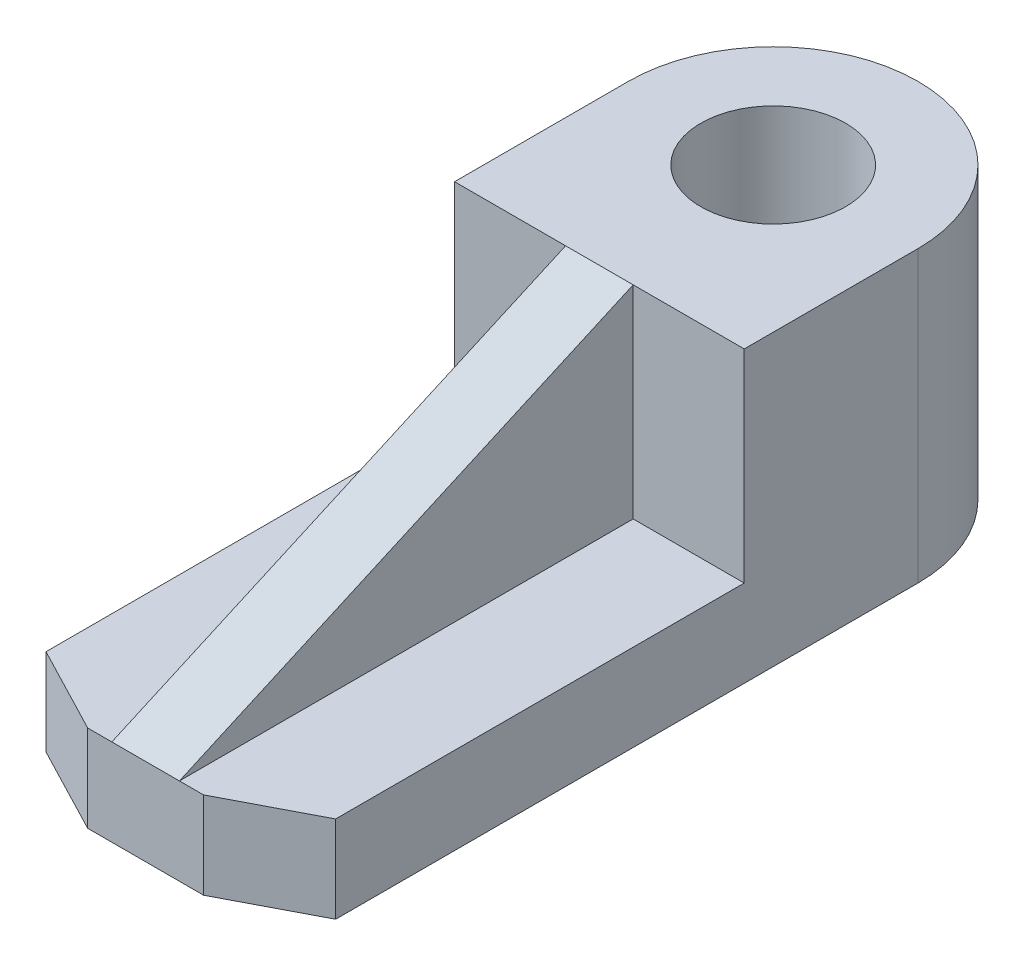
from build123d import *

# Parameters (mm, degrees)
BOSS_EXTRUDE1_DEPTH = 9
SKETCH2_R           = 7.5
BOSS_EXTRUDE2_DEPTH = 21
BOSS_EXTRUDE3_DEPTH = 3.5
SKETCH4_R           = 7.5
CUT_EXTRUDE1_DEPTH  = 85.242328054


with BuildPart() as part:
    # Sketch1 → Boss-Extrude1 (new body)
    with BuildSketch(Plane(origin=(0, 0, 0), x_dir=(1, 0, 0), z_dir=(0, 1, 0))):
        with BuildLine():
            Line((-5.007194245, 0), (6.992805755, 0))
            Line((6.992805755, 0), (15.992805755, 4.683453237))
            Line((15.992805755, 4.683453237), (15.992805755, 65))
            ThreePointArc((15.992805755, 65), (0.992805755, 80), (-14.007194245, 65))
            Line((-14.007194245, 65), (-14.007194245, 4.683453237))
            Line((-14.007194245, 4.683453237), (-5.007194245, 0))
        make_face()
    extrude(amount=BOSS_EXTRUDE1_DEPTH)

    # Sketch2 → Boss-Extrude2 (add)
    with BuildSketch(Plane(origin=(0, 9, 0), x_dir=(1, 0, 0), z_dir=(0, 1, 0))):
        with BuildLine():
            ThreePointArc((15.992805755, 65), (0.992805755, 80), (-14.007194245, 65))
            Line((-14.007194245, 65), (-14.007194245, 47))
            Line((-14.007194245, 47), (15.992805755, 47))
            Line((15.992805755, 47), (15.992805755, 65))
        make_face()
        with Locations(Location((0.992805755, 65, 0), (0, 0, 90))):
            Circle(SKETCH2_R, mode=Mode.SUBTRACT)
    extrude(amount=BOSS_EXTRUDE2_DEPTH)

    # Sketch3 → Boss-Extrude3 (add, symmetric)
    with BuildSketch(Plane(origin=(0.992805755, 0, 0), x_dir=(0, 0, -1), z_dir=(1, 0, 0))):
        Polygon((0, 9), (47, 30), (47, 9), align=None)
    extrude(amount=BOSS_EXTRUDE3_DEPTH, both=True)

    # Sketch4 → Cut-Extrude1 (cut, through all)
    with BuildSketch(Plane(origin=(0, 9, 0), x_dir=(1, 0, 0), z_dir=(0, 1, 0))):
        with Locations(Location((0.992805755, 65, 0), (0, 0, 90))):
            Circle(SKETCH4_R)
    extrude(amount=-CUT_EXTRUDE1_DEPTH, mode=Mode.SUBTRACT)


solid = part.part
